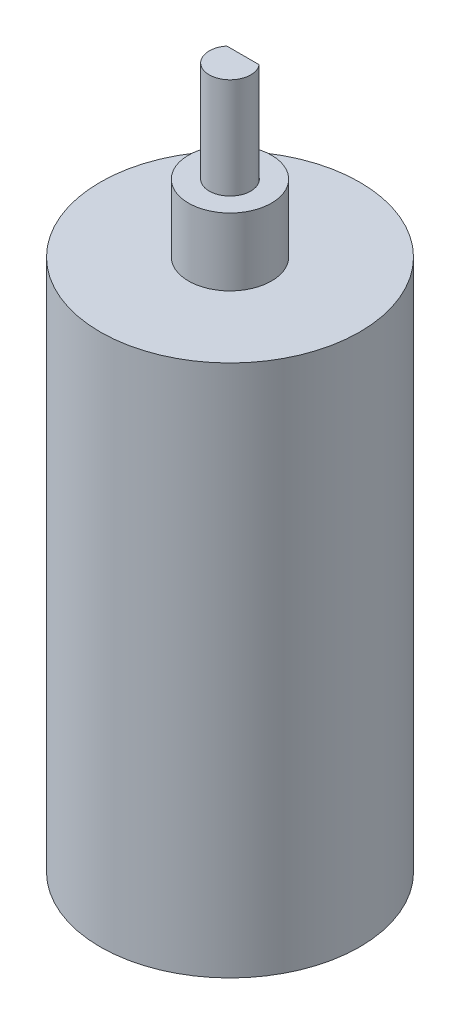
from build123d import *

# Parameters (mm, degrees)
SKETCH1_R           = 12.5
BOSS_EXTRUDE1_DEPTH = 25.65
BOSS_EXTRUDE2_DEPTH = 16.2
SKETCH2_3_R         = 4
SKETCH2_3_R_2       = 2
BOSS_EXTRUDE3_DEPTH = 6.5
CUT_EXTRUDE2_DEPTH  = 17


with BuildPart() as part:
    # Sketch1 → Boss-Extrude1 (new, symmetric)
    with BuildSketch(Plane(origin=(0, 0, 0), x_dir=(1, 0, 0), z_dir=(0, 1, 0))):
        with Locations(Location((0, 0, 0), (0, 0, 270))):
            Circle(SKETCH1_R)
    extrude(amount=BOSS_EXTRUDE1_DEPTH, both=True)

    # Sketch2 → Boss-Extrude2 (add)
    with BuildSketch(Plane(origin=(0, 25.65, 0), x_dir=(1, 0, 0), z_dir=(0, 1, 0))):
        with BuildLine():
            ThreePointArc((1.5612495, 1.25), (0, 2), (-1.5612495, 1.25))
            Line((-1.5612495, 1.25), (1.5612495, 1.25))
        make_face()
        with BuildLine():
            Line((1.5612495, 1.25), (-1.5612495, 1.25))
            ThreePointArc((-1.5612495, 1.25), (-0.662382443, -1.887127314), (2, 0))
            ThreePointArc((2, 0), (1.887127314, 0.662382443), (1.5612495, 1.25))
        make_face()
    extrude(amount=BOSS_EXTRUDE2_DEPTH)

    # Sketch2<3> → Boss-Extrude3 (add)
    with BuildSketch(Plane(origin=(0, 25.65, 0), x_dir=(1, 0, 0), z_dir=(0, 1, 0))):
        with Locations(Location((0, 0, 0), (0, 0, 90))):
            Circle(SKETCH2_3_R)
        with Locations(Location((0, 0, 0), (0, 0, 270))):
            Circle(SKETCH2_3_R_2, mode=Mode.SUBTRACT)
    extrude(amount=BOSS_EXTRUDE3_DEPTH)

    # Sketch2<4> → Cut-Extrude2 (cut)
    with BuildSketch(Plane(origin=(0, 25.65, 0), x_dir=(1, 0, 0), z_dir=(0, 1, 0))):
        with BuildLine():
            ThreePointArc((1.5612495, 1.25), (0, 2), (-1.5612495, 1.25))
            Line((-1.5612495, 1.25), (1.5612495, 1.25))
        make_face()
    extrude(amount=CUT_EXTRUDE2_DEPTH, mode=Mode.SUBTRACT)


solid = part.part
